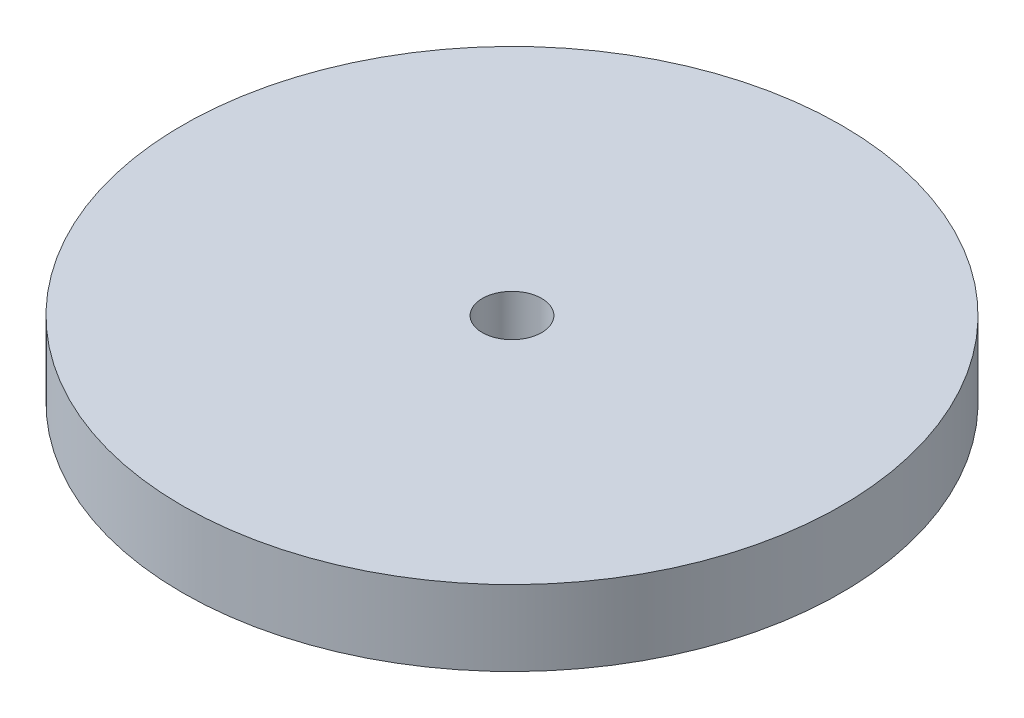
from build123d import *

# Parameters (mm, degrees)
SKETCH2_R           = 33.3375
BOSS_EXTRUDE1_DEPTH = 7.62
CUT_EXTRUDE1_REACH  = 49.758
SKETCH3_R           = 3


with BuildPart() as part:
    # Sketch2 → Boss-Extrude1 (new body)
    with BuildSketch(Plane(origin=(0, 0, 0), x_dir=(1, 0, 0), z_dir=(0, 1, 0))):
        with Locations(Location((0, 0, 0), (0, 0, 90))):
            Circle(SKETCH2_R)
    extrude(amount=BOSS_EXTRUDE1_DEPTH)

    # Sketch3 → Cut-Extrude1 (cut, up to next)
    with BuildSketch(Plane(origin=(0, 7.62, 0), x_dir=(1, 0, 0), z_dir=(0, 1, 0)), mode=Mode.PRIVATE) as cut_extrude1_sk1:
        with Locations(Location((0, 0, 0), (0, 0, 270))):
            Circle(SKETCH3_R)
    cut_extrude1_tool1 = extrude(cut_extrude1_sk1.sketch, amount=-CUT_EXTRUDE1_REACH, mode=Mode.PRIVATE) & part.part
    add(cut_extrude1_tool1.solids().sort_by_distance((0, 7.62, 0))[0], mode=Mode.SUBTRACT)


solid = part.part
